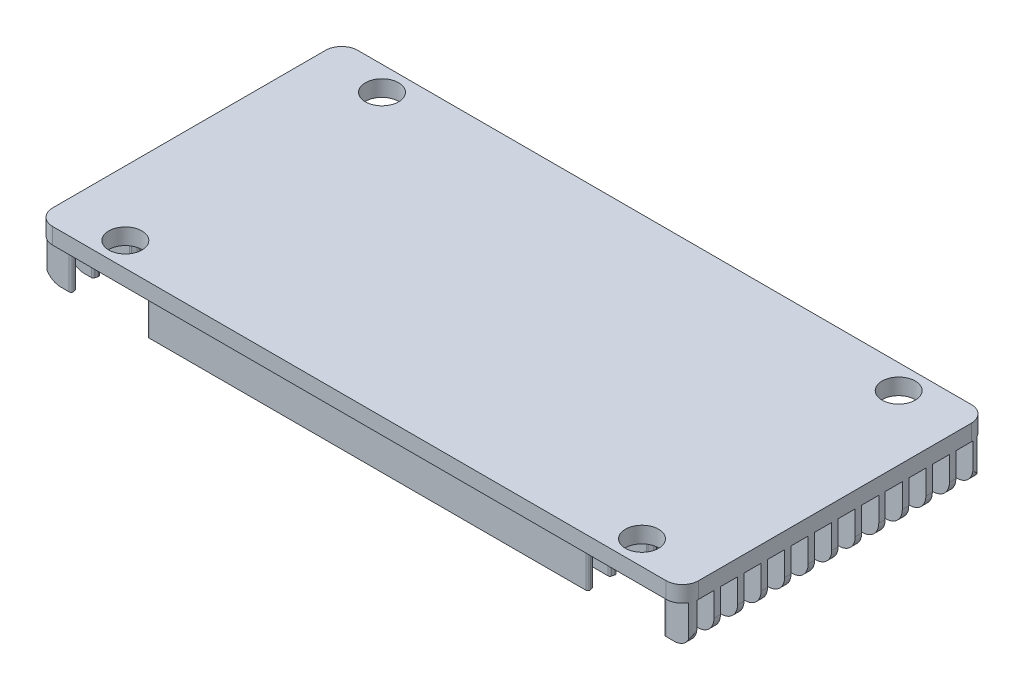
from build123d import *

# Parameters (mm, degrees)
SKETCH1_W               = 127
SKETCH1_H               = 60
BOSS_EXTRUDE1_DEPTH     = 3.175
F_1_4_28_TAPPED_HOLE1_D = 5.4102
FILLET1_R               = 3.175
SKETCH14_W              = 127
SKETCH14_H              = 1.27
BOSS_EXTRUDE2_DEPTH     = 7.9375
CUT_EXTRUDE2_DEPTH      = 72.103710566
CUT_EXTRUDE2_DEPTH_BACK = 72.103710566
SKETCH15_OUTSIDE_W      = 157.18
SKETCH15_OUTSIDE_H      = 90.18
SKETCH15_OUTSIDE_R      = 2.7051
SKETCH16_R              = 7.9375
CUT_EXTRUDE3_DEPTH      = 71.6771102
FILLET2_R               = 0.396875
CUT_EXTRUDE4_DEPTH      = 87.64452702
SKETCH19_R              = 3.2639
CUT_EXTRUDE5_DEPTH      = 71.6771102


with BuildPart() as part:
    # Sketch1 → Boss-Extrude1 (new body)
    with BuildSketch(Plane(origin=(0, 0, 0), x_dir=(1, 0, 0), z_dir=(0, 1, 0))):
        Rectangle(SKETCH1_W, SKETCH1_H)
    extrude(amount=BOSS_EXTRUDE1_DEPTH)

    # 1/4-28 Tapped Hole1 (through all)
    with Locations(Plane(origin=(0, 0, 0), x_dir=(-1, 0, 0), z_dir=(0, -1, 0))):
        with Locations((-50.8, 25.2375), (50.8, 25.2375), (50.8, -25.2375), (-50.8, -25.2375)):
            Hole(F_1_4_28_TAPPED_HOLE1_D / 2)

    # Fillet1
    fillet1_edges = [part.edges().sort_by_distance(p)[0] for p in [
        (63.5, 1.5875, 30),
        (63.5, 1.5875, -30),
        (-63.5, 1.5875, -30),
        (-63.5, 1.5875, 30),
    ]]
    fillet(fillet1_edges, radius=FILLET1_R)

    # Sketch14 → Boss-Extrude2 (add)
    with BuildSketch(Plane.XZ):
        with Locations((0, 27.7775)):
            Rectangle(SKETCH14_W, SKETCH14_H)
        with Locations((0, 23.147916667)):
            Rectangle(SKETCH14_W, SKETCH14_H)
        with Locations((0, 18.518333333)):
            Rectangle(SKETCH14_W, SKETCH14_H)
        with Locations((0, 13.88875)):
            Rectangle(SKETCH14_W, SKETCH14_H)
        with Locations((0, 9.259166667)):
            Rectangle(SKETCH14_W, SKETCH14_H)
        with Locations((0, 4.629583333)):
            Rectangle(SKETCH14_W, SKETCH14_H)
        Rectangle(SKETCH14_W, SKETCH14_H)
        with Locations((0, -4.629583333)):
            Rectangle(SKETCH14_W, SKETCH14_H)
        with Locations((0, -9.259166667)):
            Rectangle(SKETCH14_W, SKETCH14_H)
        with Locations((0, -13.88875)):
            Rectangle(SKETCH14_W, SKETCH14_H)
        with Locations((0, -27.7775)):
            Rectangle(SKETCH14_W, SKETCH14_H)
        with Locations((0, -18.518333333)):
            Rectangle(SKETCH14_W, SKETCH14_H)
        with Locations((0, -23.147916667)):
            Rectangle(SKETCH14_W, SKETCH14_H)
    extrude(amount=BOSS_EXTRUDE2_DEPTH)

    # Sketch15 outside → Cut-Extrude2 (cut, two sides: drawn at the far end of the back side and taken through both)
    # profile 1 of 5: a face of its own
    with BuildSketch(Plane(origin=(0, 3.175, 0), x_dir=(1, 0, 0), z_dir=(0, 1, 0)).offset(-CUT_EXTRUDE2_DEPTH_BACK)):
        Rectangle(SKETCH15_OUTSIDE_W, SKETCH15_OUTSIDE_H)
        with BuildLine():
            Line((-60.325, -30), (60.325, -30))
            ThreePointArc((60.325, -30), (62.57006403, -29.07006403), (63.5, -26.825))
            Line((63.5, -26.825), (63.5, 26.825))
            ThreePointArc((63.5, 26.825), (62.57006403, 29.07006403), (60.325, 30))
            Line((60.325, 30), (-60.325, 30))
            ThreePointArc((-60.325, 30), (-62.57006403, 29.07006403), (-63.5, 26.825))
            Line((-63.5, 26.825), (-63.5, -26.825))
            ThreePointArc((-63.5, -26.825), (-62.57006403, -29.07006403), (-60.325, -30))
        make_face(mode=Mode.SUBTRACT)
    # profile 2 of 5: a face of its own
    with BuildSketch(Plane(origin=(0, 3.175, 0), x_dir=(1, 0, 0), z_dir=(0, 1, 0)).offset(-CUT_EXTRUDE2_DEPTH_BACK)):
        with Locations((50.8, -25.2375)):
            Circle(SKETCH15_OUTSIDE_R)
    # profile 3 of 5: a face of its own
    with BuildSketch(Plane(origin=(0, 3.175, 0), x_dir=(1, 0, 0), z_dir=(0, 1, 0)).offset(-CUT_EXTRUDE2_DEPTH_BACK)):
        with Locations((-50.8, -25.2375)):
            Circle(SKETCH15_OUTSIDE_R)
    # profile 4 of 5: a face of its own
    with BuildSketch(Plane(origin=(0, 3.175, 0), x_dir=(1, 0, 0), z_dir=(0, 1, 0)).offset(-CUT_EXTRUDE2_DEPTH_BACK)):
        with Locations((-50.8, 25.2375)):
            Circle(SKETCH15_OUTSIDE_R)
    # profile 5 of 5: a face of its own
    with BuildSketch(Plane(origin=(0, 3.175, 0), x_dir=(1, 0, 0), z_dir=(0, 1, 0)).offset(-CUT_EXTRUDE2_DEPTH_BACK)):
        with Locations((50.8, 25.2375)):
            Circle(SKETCH15_OUTSIDE_R)
    extrude(amount=CUT_EXTRUDE2_DEPTH + CUT_EXTRUDE2_DEPTH_BACK, mode=Mode.SUBTRACT)

    # Sketch16 → Cut-Extrude3 (cut, through all)
    with BuildSketch(Plane.XZ):
        with Locations((-50.8, 25.2375)):
            Circle(SKETCH16_R)
        with Locations((50.8, 25.2375)):
            Circle(SKETCH16_R)
        with Locations((50.8, -25.2375)):
            Circle(SKETCH16_R)
        with Locations((-50.8, -25.2375)):
            Circle(SKETCH16_R)
    extrude(amount=CUT_EXTRUDE3_DEPTH, mode=Mode.SUBTRACT)

    # Fillet2
    fillet2_edges = [part.edges().sort_by_distance(p)[0] for p in [
        (58.255236543, -3.96875, 22.512916667),
        (58.603082313, -3.96875, 23.782916667),
        (58.505509798, -3.96875, 27.1425),
        (58.074838916, -3.96875, 28.4125),
        (-58.255236543, -3.96875, 22.512916667),
        (-58.603082313, -3.96875, 23.782916667),
        (-58.074838916, -3.96875, 28.4125),
        (-58.505509798, -3.96875, 27.1425),
        (42.996917687, -3.96875, 23.782916667),
        (-42.996917687, -3.96875, 23.782916667),
        (-43.344763457, -3.96875, 22.512916667),
        (43.344763457, -3.96875, 22.512916667),
        (43.094490202, -3.96875, 27.1425),
        (43.525161084, -3.96875, 28.4125),
        (-43.094490202, -3.96875, 27.1425),
        (-43.525161084, -3.96875, 28.4125),
        (58.074838916, -3.96875, -28.4125),
        (58.505509798, -3.96875, -27.1425),
        (58.603082313, -3.96875, -23.782916667),
        (58.255236543, -3.96875, -22.512916667),
        (55.897727162, -3.96875, -19.153333333),
        (53.786660156, -3.96875, -17.883333333),
        (43.525161084, -3.96875, -28.4125),
        (43.094490202, -3.96875, -27.1425),
        (42.996917687, -3.96875, -23.782916667),
        (43.344763457, -3.96875, -22.512916667),
        (45.702272838, -3.96875, -19.153333333),
        (47.813339844, -3.96875, -17.883333333),
        (47.813339844, -3.96875, 17.883333333),
        (45.702272838, -3.96875, 19.153333333),
        (55.897727162, -3.96875, 19.153333333),
        (53.786660156, -3.96875, 17.883333333),
        (-43.525161084, -3.96875, -28.4125),
        (-43.094490202, -3.96875, -27.1425),
        (-42.996917687, -3.96875, -23.782916667),
        (-43.344763457, -3.96875, -22.512916667),
        (-45.702272838, -3.96875, -19.153333333),
        (-47.813339844, -3.96875, -17.883333333),
        (-58.074838916, -3.96875, -28.4125),
        (-58.505509798, -3.96875, -27.1425),
        (-58.603082313, -3.96875, -23.782916667),
        (-58.255236543, -3.96875, -22.512916667),
        (-55.897727162, -3.96875, -19.153333333),
        (-53.786660156, -3.96875, -17.883333333),
        (-53.786660156, -3.96875, 17.883333333),
        (-55.897727162, -3.96875, 19.153333333),
        (-45.702272838, -3.96875, 19.153333333),
        (-47.813339844, -3.96875, 17.883333333),
    ]]
    fillet(fillet2_edges, radius=FILLET2_R)

    # Sketch17 → Cut-Extrude4 (cut, through all)
    with BuildSketch(Plane.XY.offset(28.4125)):
        with BuildLine():
            Line((-63.5, -7.9375), (-63.5, -4.7625))
            ThreePointArc((-63.5, -4.7625), (-62.57006403, -7.00756403), (-60.325, -7.9375))
            Line((-60.325, -7.9375), (-63.5, -7.9375))
        make_face()
        with BuildLine():
            Line((63.5, -7.9375), (63.5, -4.7625))
            ThreePointArc((63.5, -4.7625), (62.57006403, -7.00756403), (60.325, -7.9375))
            Line((60.325, -7.9375), (63.5, -7.9375))
        make_face()
    extrude(amount=-CUT_EXTRUDE4_DEPTH, mode=Mode.SUBTRACT)

    # Sketch19 → Cut-Extrude5 (cut, through all)
    with BuildSketch(Plane.XZ):
        with Locations((-50.8, 25.2375)):
            Circle(SKETCH19_R)
        with Locations((50.8, 25.2375)):
            Circle(SKETCH19_R)
        with Locations((50.8, -25.2375)):
            Circle(SKETCH19_R)
        with Locations((-50.8, -25.2375)):
            Circle(SKETCH19_R)
    extrude(amount=-CUT_EXTRUDE5_DEPTH, mode=Mode.SUBTRACT)


solid = part.part
